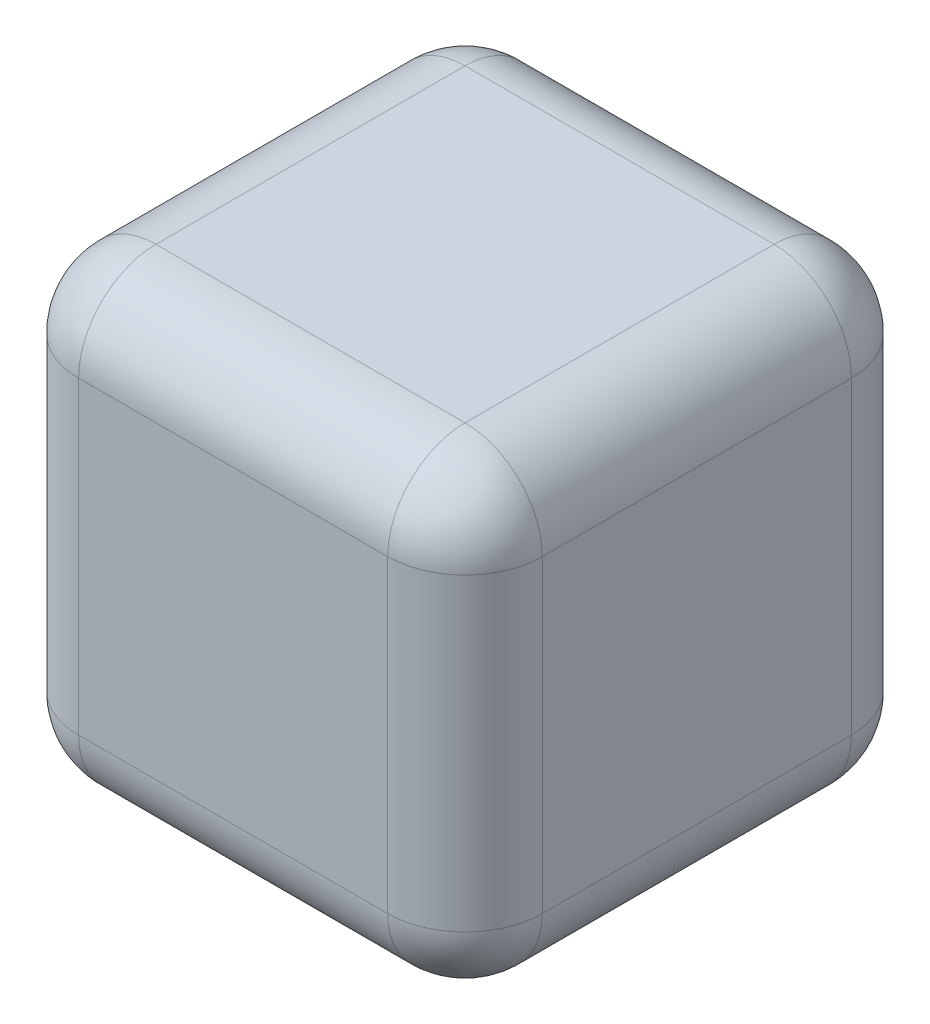
from build123d import *

# Parameters (mm, degrees)
BOSS_EXTRUDE1_DEPTH      = 300
BOSS_EXTRUDE1_DEPTH_BACK = 300
SKETCH2_W                = 600
SKETCH2_H                = 600
FILLET4_R                = 100


with BuildPart() as part:
    # Sketch2 → Boss-Extrude1 (new, two sides: drawn at the far end of the back side and taken through both)
    with BuildSketch(Plane(origin=(0, 0, 0), x_dir=(1, 0, 0), z_dir=(0, 1, 0)).offset(-BOSS_EXTRUDE1_DEPTH_BACK)):
        Rectangle(SKETCH2_W, SKETCH2_H)
    extrude(amount=BOSS_EXTRUDE1_DEPTH + BOSS_EXTRUDE1_DEPTH_BACK)

    # Fillet4
    fillet4_edges = [part.edges().sort_by_distance(p)[0] for p in [
        (300, 300, 0),
        (0, 300, 300),
        (300, 0, 300),
        (0, -300, 300),
        (300, -300, 0),
        (-300, -300, 0),
        (-300, 300, 0),
        (-300, 0, 300),
        (0, -300, -300),
        (300, 0, -300),
        (0, 300, -300),
        (-300, 0, -300),
    ]]
    fillet(fillet4_edges, radius=FILLET4_R)


solid = part.part
